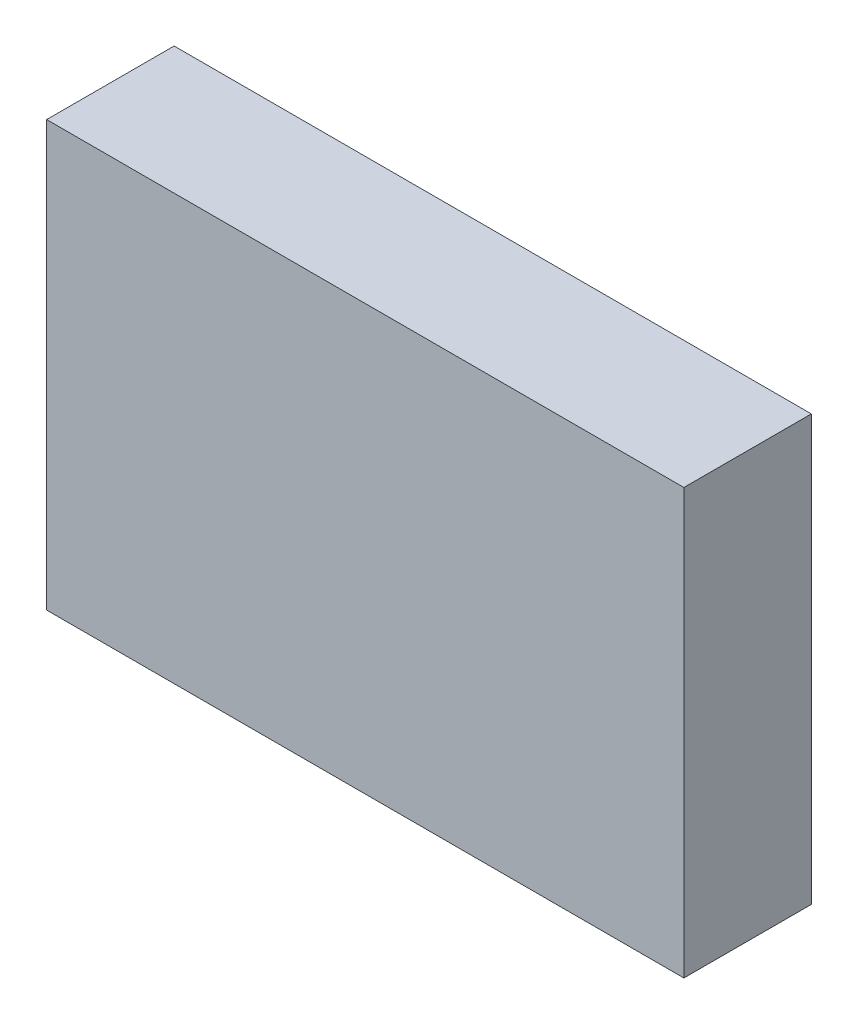
from build123d import *

# Parameters (mm, degrees)
SKETCH_1_W      = 150
SKETCH_1_H      = 100
EXTRUDE_1_DEPTH = 30


with BuildPart() as part:
    # 草图1 → 凸台-拉伸1 (new body)
    with BuildSketch(Plane.XY):
        Rectangle(SKETCH_1_W, SKETCH_1_H)
    extrude(amount=EXTRUDE_1_DEPTH)


solid = part.part
